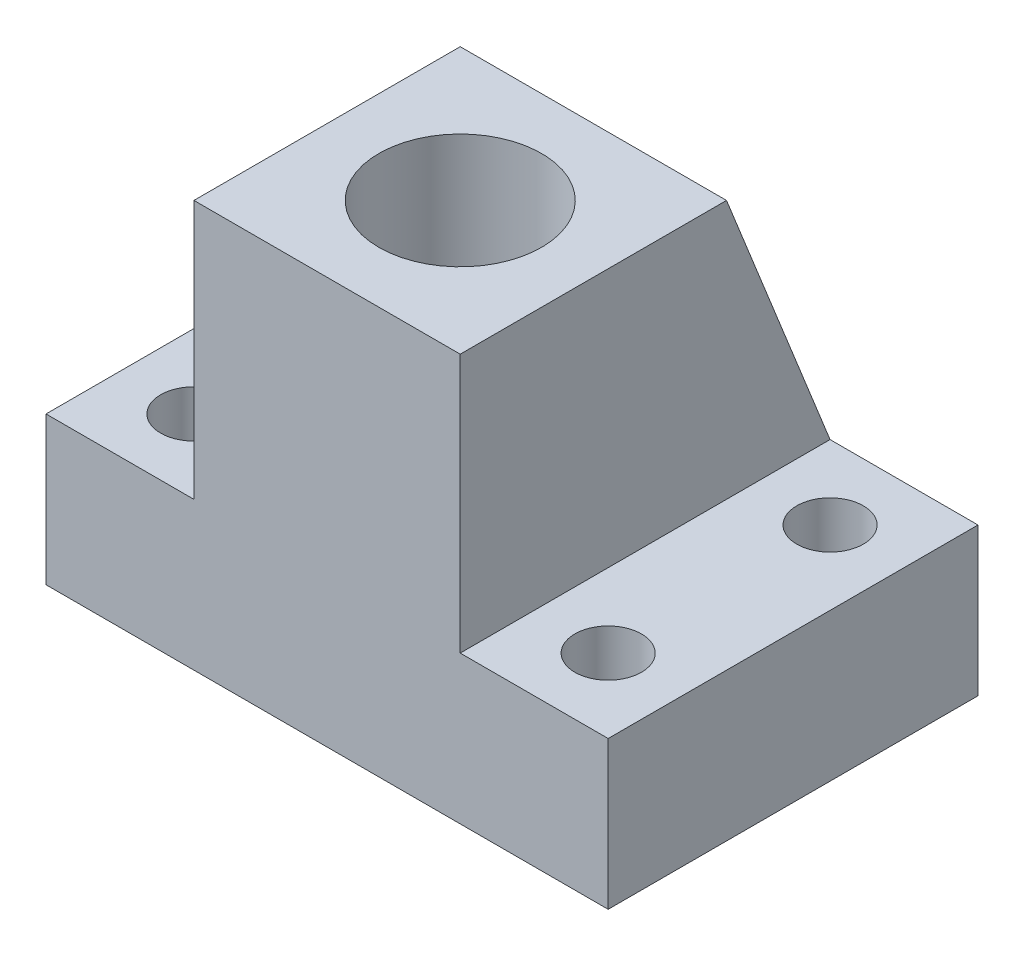
from build123d import *

# Parameters (mm, degrees)
SALIENTE_EXTRUIR1_DEPTH      = 18
SALIENTE_EXTRUIR1_DEPTH_BACK = 32
CROQUIS2_R                   = 11
CORTAR_EXTRUIR1_DEPTH        = 30
CORTAR_EXTRUIR2_START        = -16
CROQUIS3_R                   = 11
CORTAR_EXTRUIR2_DEPTH        = 16
CORTAR_EXTRUIR3_REACH        = 60.034
CROQUIS4_R                   = 5.5
CORTAR_EXTRUIR4_REACH        = 86.764
CORTAR_EXTRUIR5_REACH        = 62.77
CROQUIS6_R                   = 4.5


with BuildPart() as part:
    # Croquis1 → Saliente-Extruir1 (new, two sides: drawn at the far end of the back side and taken through both)
    with BuildSketch(Plane.XY.offset(-SALIENTE_EXTRUIR1_DEPTH_BACK)):
        Polygon((38, 0), (-38, 0), (-38, 20), (-18, 20), (-18, 55), (18, 55), (18, 20), (38, 20), align=None)
    extrude(amount=SALIENTE_EXTRUIR1_DEPTH + SALIENTE_EXTRUIR1_DEPTH_BACK)

    # Croquis2 → Cortar-Extruir1 (cut)
    with BuildSketch(Plane(origin=(0, 55, 0), x_dir=(1, 0, 0), z_dir=(0, 1, 0))):
        with Locations(Location((0, 0, 0), (0, 0, 270))):
            Circle(CROQUIS2_R)
    extrude(amount=-CORTAR_EXTRUIR1_DEPTH, mode=Mode.SUBTRACT)

    # Croquis3 → Cortar-Extruir2 (cut)
    with BuildSketch(Plane.XZ.offset(CORTAR_EXTRUIR2_START)):
        with Locations(Location((0, 0, 0), (0, 0, 90))):
            Circle(CROQUIS3_R)
    extrude(amount=CORTAR_EXTRUIR2_DEPTH, mode=Mode.SUBTRACT)

    # Croquis4 → Cortar-Extruir3 (cut, up to next)
    with BuildSketch(Plane(origin=(0, 25, 0), x_dir=(1, 0, 0), z_dir=(0, 1, 0)), mode=Mode.PRIVATE) as cortar_extruir3_sk1:
        with Locations(Location((0, 0, 0), (0, 0, 270))):
            Circle(CROQUIS4_R)
    cortar_extruir3_tool1 = extrude(cortar_extruir3_sk1.sketch, amount=-CORTAR_EXTRUIR3_REACH, mode=Mode.PRIVATE) & part.part
    add(cortar_extruir3_tool1.solids().sort_by_distance((0, 25, 0))[0], mode=Mode.SUBTRACT)

    # Croquis5 → Cortar-Extruir4 (cut, up to next)
    with BuildSketch(Plane(origin=(18, 0, 0), x_dir=(0, 0, -1), z_dir=(1, 0, 0)), mode=Mode.PRIVATE) as cortar_extruir4_sk1:
        Polygon((32, 55), (32, 20), (18, 55), align=None)
    cortar_extruir4_tool1 = extrude(cortar_extruir4_sk1.sketch, amount=-CORTAR_EXTRUIR4_REACH, mode=Mode.PRIVATE) & part.part
    add(cortar_extruir4_tool1.solids().sort_by_distance((18, 43.333333, -27.333333))[0], mode=Mode.SUBTRACT)

    # Croquis6 → Cortar-Extruir5 (cut, up to next)
    with BuildSketch(Plane(origin=(0, 20, 0), x_dir=(1, 0, 0), z_dir=(0, 1, 0)), mode=Mode.PRIVATE) as cortar_extruir5_sk1:
        with Locations(Location((-28, 22, 0), (0, 0, 270))):
            Circle(CROQUIS6_R)
    cortar_extruir5_tool1 = extrude(cortar_extruir5_sk1.sketch, amount=-CORTAR_EXTRUIR5_REACH, mode=Mode.PRIVATE) & part.part
    # Croquis6 → Cortar-Extruir5 (cut, up to next)
    with BuildSketch(Plane(origin=(0, 20, 0), x_dir=(1, 0, 0), z_dir=(0, 1, 0)), mode=Mode.PRIVATE) as cortar_extruir5_sk2:
        with Locations(Location((-28, -8, 0), (0, 0, 270))):
            Circle(CROQUIS6_R)
    cortar_extruir5_tool2 = extrude(cortar_extruir5_sk2.sketch, amount=-CORTAR_EXTRUIR5_REACH, mode=Mode.PRIVATE) & part.part
    # Croquis6 → Cortar-Extruir5 (cut, up to next)
    with BuildSketch(Plane(origin=(0, 20, 0), x_dir=(1, 0, 0), z_dir=(0, 1, 0)), mode=Mode.PRIVATE) as cortar_extruir5_sk3:
        with Locations(Location((28, 22, 0), (0, 0, 270))):
            Circle(CROQUIS6_R)
    cortar_extruir5_tool3 = extrude(cortar_extruir5_sk3.sketch, amount=-CORTAR_EXTRUIR5_REACH, mode=Mode.PRIVATE) & part.part
    # Croquis6 → Cortar-Extruir5 (cut, up to next)
    with BuildSketch(Plane(origin=(0, 20, 0), x_dir=(1, 0, 0), z_dir=(0, 1, 0)), mode=Mode.PRIVATE) as cortar_extruir5_sk4:
        with Locations(Location((28, -8, 0), (0, 0, 270))):
            Circle(CROQUIS6_R)
    cortar_extruir5_tool4 = extrude(cortar_extruir5_sk4.sketch, amount=-CORTAR_EXTRUIR5_REACH, mode=Mode.PRIVATE) & part.part
    add(cortar_extruir5_tool1.solids().sort_by_distance((-28, 20, -22))[0], mode=Mode.SUBTRACT)
    add(cortar_extruir5_tool2.solids().sort_by_distance((-28, 20, 8))[0], mode=Mode.SUBTRACT)
    add(cortar_extruir5_tool3.solids().sort_by_distance((28, 20, -22))[0], mode=Mode.SUBTRACT)
    add(cortar_extruir5_tool4.solids().sort_by_distance((28, 20, 8))[0], mode=Mode.SUBTRACT)


solid = part.part
